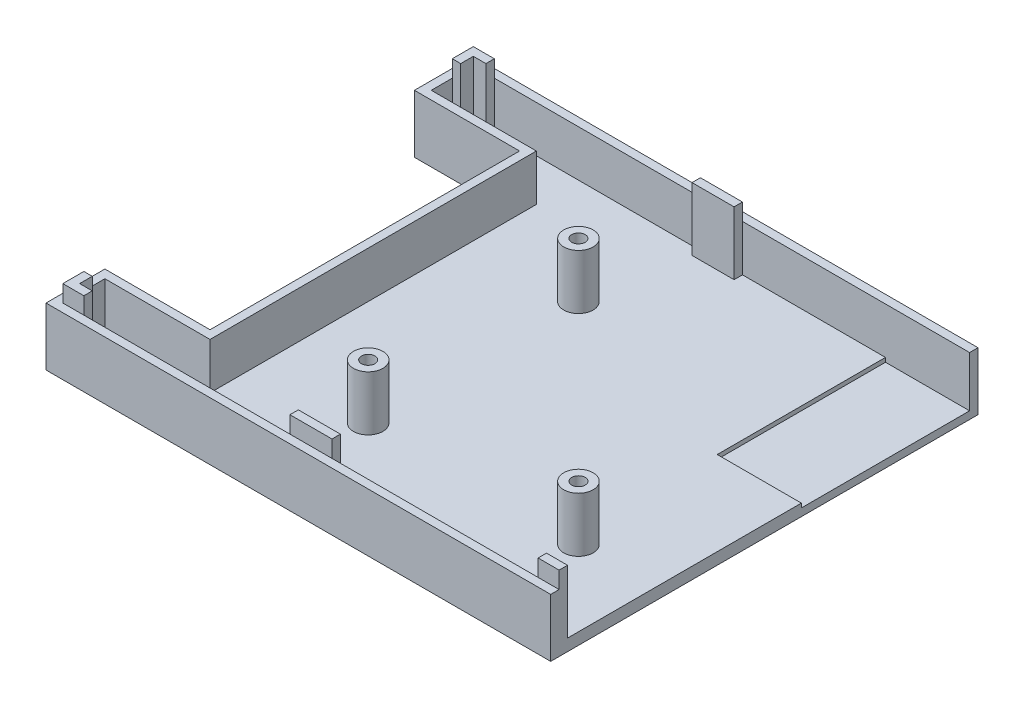
from build123d import *

# Parameters (mm, degrees)
SKETCH_1_W           = 120
SKETCH_1_H           = 101.6
EXTRUDE_1_DEPTH      = 13.8
CUT_EXTRUDE_1_REACH  = 159.839
SKETCH_2_W           = 25
SKETCH_2_H           = 73.6
SKETCH_4_W           = 93
SKETCH_4_H           = 97.6
CUT_EXTRUDE_2_DEPTH  = 11
SKETCH_6_W           = 25
SKETCH_6_H           = 10
CUT_EXTRUDE_3_DEPTH  = 11
SKETCH_7_W           = 5
SKETCH_7_H           = 2
SKETCH_7_W_2         = 10
EXTRUDE_2_DEPTH      = 15
SKETCH_14_W          = 20
SKETCH_14_H          = 40
CUT_EXTRUDE_9_DEPTH  = 16
SKETCH_15_R          = 3.5
EXTRUDE_3_DEPTH      = 13
CUT_EXTRUDE_10_REACH = 160.026
SKETCH_16_R          = 1.6
SKETCH_17_R          = 2.65
CUT_EXTRUDE_11_DEPTH = 8
CHAMFER_1_SIZE       = 2


with BuildPart() as part:
    # 草图1 → 凸台-拉伸1 (new body)
    with BuildSketch(Plane(origin=(0, 0, 0), x_dir=(1, 0, 0), z_dir=(0, 1, 0))):
        with Locations((60, -50.8)):
            Rectangle(SKETCH_1_W, SKETCH_1_H)
    extrude(amount=EXTRUDE_1_DEPTH)

    # 草图2 → 切除-拉伸1 (cut, up to next)
    with BuildSketch(Plane(origin=(0, 13.8, 0), x_dir=(1, 0, 0), z_dir=(0, 1, 0)), mode=Mode.PRIVATE) as cut_extrude_1_sk1:
        with Locations((12.5, -50.8)):
            Rectangle(SKETCH_2_W, SKETCH_2_H)
    cut_extrude_1_tool1 = extrude(cut_extrude_1_sk1.sketch, amount=-CUT_EXTRUDE_1_REACH, mode=Mode.PRIVATE) & part.part
    add(cut_extrude_1_tool1.solids().sort_by_distance((12.5, 13.8, 50.8))[0], mode=Mode.SUBTRACT)

    # 草图4 → 切除-拉伸2 (cut)
    with BuildSketch(Plane(origin=(0, 13.8, 0), x_dir=(1, 0, 0), z_dir=(0, 1, 0))):
        with Locations((73.5, -50.8)):
            Rectangle(SKETCH_4_W, SKETCH_4_H)
    extrude(amount=-CUT_EXTRUDE_2_DEPTH, mode=Mode.SUBTRACT)

    # 草图6 → 切除-拉伸3 (cut)
    with BuildSketch(Plane(origin=(0, 13.8, 0), x_dir=(1, 0, 0), z_dir=(0, 1, 0))):
        with Locations((14.5, -94.6)):
            Rectangle(SKETCH_6_W, SKETCH_6_H)
    cut_extrude_3 = extrude(amount=-CUT_EXTRUDE_3_DEPTH, mode=Mode.SUBTRACT)

    # 镜向1: 切除-拉伸3 across plane
    add(cut_extrude_3.mirror(Plane(origin=(0, 0, 50.8), x_dir=(1, 0, 0), z_dir=(0, 0, -1))), mode=Mode.SUBTRACT)

    # 草图7 → 凸台-拉伸2 (add)
    with BuildSketch(Plane(origin=(0, 2.8, 0), x_dir=(1, 0, 0), z_dir=(0, 1, 0))):
        Polygon((2, -94.6), (4, -94.6), (4, -97.6), (7, -97.6), (7, -99.6), (2, -99.6), align=None)
        with Locations((117.5, -98.6)):
            Rectangle(SKETCH_7_W, SKETCH_7_H)
        with Locations((61, -98.6)):
            Rectangle(SKETCH_7_W_2, SKETCH_7_H)
    extrude_2 = extrude(amount=EXTRUDE_2_DEPTH)

    # 镜向2: 凸台-拉伸2 across plane
    add(extrude_2.mirror(Plane(origin=(0, 0, 50.8), x_dir=(1, 0, 0), z_dir=(0, 0, -1))))

    # 草图14 → 切除-拉伸9 (cut)
    with BuildSketch(Plane(origin=(0, 17.8, 0), x_dir=(1, 0, 0), z_dir=(0, 1, 0))):
        with Locations((110, -22)):
            Rectangle(SKETCH_14_W, SKETCH_14_H)
    extrude(amount=-CUT_EXTRUDE_9_DEPTH, mode=Mode.SUBTRACT)

    # 草图15 → 凸台-拉伸3 (add)
    with BuildSketch(Plane(origin=(0, 2.8, 0), x_dir=(1, 0, 0), z_dir=(0, 1, 0))):
        with Locations(Location((52, -27, 0), (0, 0, 90))):
            Circle(SKETCH_15_R)
        with Locations(Location((52, -77, 0), (0, 0, 90))):
            Circle(SKETCH_15_R)
        with Locations(Location((102, -77, 0), (0, 0, 90))):
            Circle(SKETCH_15_R)
    extrude(amount=EXTRUDE_3_DEPTH)

    # 草图16 → 切除-拉伸10 (cut, up to next)
    with BuildSketch(Plane(origin=(0, 15.8, 0), x_dir=(1, 0, 0), z_dir=(0, 1, 0)), mode=Mode.PRIVATE) as cut_extrude_10_sk1:
        with Locations(Location((52, -27, 0), (0, 0, 270))):
            Circle(SKETCH_16_R)
    cut_extrude_10_tool1 = extrude(cut_extrude_10_sk1.sketch, amount=-CUT_EXTRUDE_10_REACH, mode=Mode.PRIVATE) & part.part
    # 草图16 → 切除-拉伸10 (cut, up to next)
    with BuildSketch(Plane(origin=(0, 15.8, 0), x_dir=(1, 0, 0), z_dir=(0, 1, 0)), mode=Mode.PRIVATE) as cut_extrude_10_sk2:
        with Locations(Location((52, -77, 0), (0, 0, 270))):
            Circle(SKETCH_16_R)
    cut_extrude_10_tool2 = extrude(cut_extrude_10_sk2.sketch, amount=-CUT_EXTRUDE_10_REACH, mode=Mode.PRIVATE) & part.part
    # 草图16 → 切除-拉伸10 (cut, up to next)
    with BuildSketch(Plane(origin=(0, 15.8, 0), x_dir=(1, 0, 0), z_dir=(0, 1, 0)), mode=Mode.PRIVATE) as cut_extrude_10_sk3:
        with Locations(Location((102, -77, 0), (0, 0, 270))):
            Circle(SKETCH_16_R)
    cut_extrude_10_tool3 = extrude(cut_extrude_10_sk3.sketch, amount=-CUT_EXTRUDE_10_REACH, mode=Mode.PRIVATE) & part.part
    add(cut_extrude_10_tool1.solids().sort_by_distance((52, 15.8, 27))[0], mode=Mode.SUBTRACT)
    add(cut_extrude_10_tool2.solids().sort_by_distance((52, 15.8, 77))[0], mode=Mode.SUBTRACT)
    add(cut_extrude_10_tool3.solids().sort_by_distance((102, 15.8, 77))[0], mode=Mode.SUBTRACT)

    # 草图17 → 切除-拉伸11 (cut)
    with BuildSketch(Plane.XZ):
        with Locations(Location((52, 77, 0), (0, 0, 270))):
            Circle(SKETCH_17_R)
        with Locations(Location((52, 27, 0), (0, 0, 90))):
            Circle(SKETCH_17_R)
        with Locations(Location((102, 77, 0), (0, 0, 270))):
            Circle(SKETCH_17_R)
    extrude(amount=-CUT_EXTRUDE_11_DEPTH, mode=Mode.SUBTRACT)

    # 倒角1
    chamfer_1_edges = [part.edges().sort_by_distance(p)[0] for p in [
        (102, 0, 79.65),
        (52, 0, 24.35),
        (52, 0, 79.65),
    ]]
    chamfer(chamfer_1_edges, length=CHAMFER_1_SIZE)


solid = part.part
